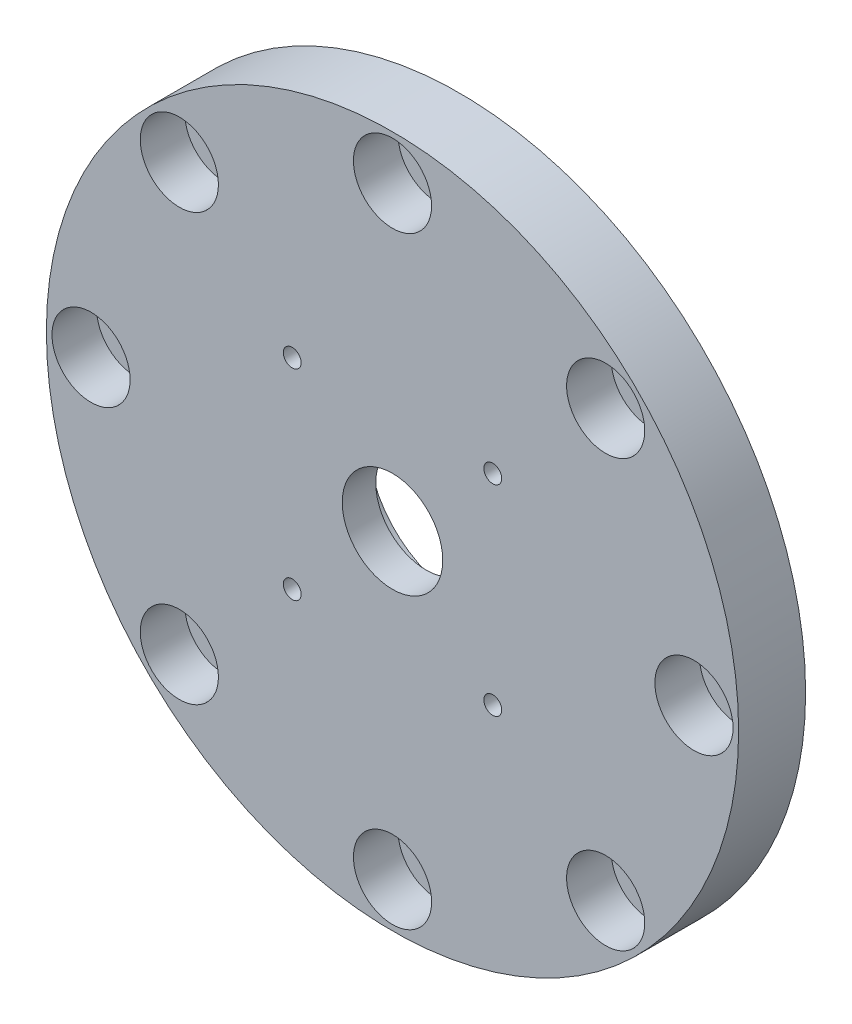
from build123d import *

# Parameters (mm, degrees)
SKETCH1_R           = 31
SKETCH1_R_2         = 4.5
SKETCH1_R_3         = 0.8
SKETCH1_R_4         = 1.55
BOSS_EXTRUDE2_DEPTH = 6
SKETCH5_R           = 8.2
CUT_EXTRUDE3_DEPTH  = 3
SKETCH6_R           = 3.5
CUT_EXTRUDE4_DEPTH  = 4


with BuildPart() as part:
    # Sketch1 → Boss-Extrude2 (new body)
    with BuildSketch(Plane.XY):
        Circle(SKETCH1_R)
        Circle(SKETCH1_R_2, mode=Mode.SUBTRACT)
        with Locations((8.980256121, 8.980256121)):
            Circle(SKETCH1_R_3, mode=Mode.SUBTRACT)
        with Locations((8.980256121, -8.980256121)):
            Circle(SKETCH1_R_3, mode=Mode.SUBTRACT)
        with Locations((-8.980256121, -8.980256121)):
            Circle(SKETCH1_R_3, mode=Mode.SUBTRACT)
        with Locations((-8.980256121, 8.980256121)):
            Circle(SKETCH1_R_3, mode=Mode.SUBTRACT)
        with Locations((-27, 0)):
            Circle(SKETCH1_R_4, mode=Mode.SUBTRACT)
        with Locations((-19.091883092, 19.091883092)):
            Circle(SKETCH1_R_4, mode=Mode.SUBTRACT)
        with Locations((0, 27)):
            Circle(SKETCH1_R_4, mode=Mode.SUBTRACT)
        with Locations((19.091883092, 19.091883092)):
            Circle(SKETCH1_R_4, mode=Mode.SUBTRACT)
        with Locations((27, 0)):
            Circle(SKETCH1_R_4, mode=Mode.SUBTRACT)
        with Locations((19.091883092, -19.091883092)):
            Circle(SKETCH1_R_4, mode=Mode.SUBTRACT)
        with Locations((0, -27)):
            Circle(SKETCH1_R_4, mode=Mode.SUBTRACT)
        with Locations((-19.091883092, -19.091883092)):
            Circle(SKETCH1_R_4, mode=Mode.SUBTRACT)
    extrude(amount=BOSS_EXTRUDE2_DEPTH)

    # Sketch5 → Cut-Extrude3 (cut)
    with BuildSketch(Plane(origin=(0, 0, 0), x_dir=(-1, 0, 0), z_dir=(0, 0, -1))):
        Circle(SKETCH5_R)
    extrude(amount=-CUT_EXTRUDE3_DEPTH, mode=Mode.SUBTRACT)

    # Sketch6 → Cut-Extrude4 (cut)
    with BuildSketch(Plane.XY.offset(6)):
        with Locations((0, 27)):
            Circle(SKETCH6_R)
        with Locations((19.091883092, 19.091883092)):
            Circle(SKETCH6_R)
        with Locations((27, 0)):
            Circle(SKETCH6_R)
        with Locations((19.091883092, -19.091883092)):
            Circle(SKETCH6_R)
        with Locations((0, -27)):
            Circle(SKETCH6_R)
        with Locations((-19.091883092, -19.091883092)):
            Circle(SKETCH6_R)
        with Locations((-27, 0)):
            Circle(SKETCH6_R)
        with Locations((-19.091883092, 19.091883092)):
            Circle(SKETCH6_R)
    extrude(amount=-CUT_EXTRUDE4_DEPTH, mode=Mode.SUBTRACT)


solid = part.part
